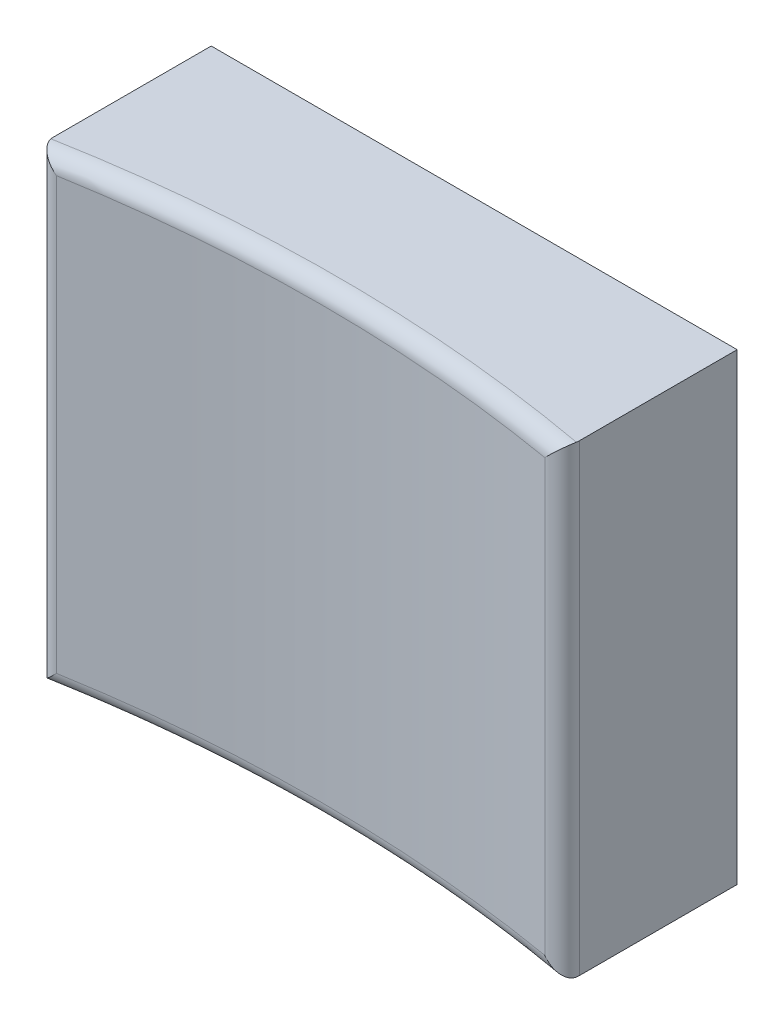
from build123d import *

# Parameters (mm, degrees)
SKETCH1_W      = 8.3058
SKETCH1_H      = 7.3152
KEY_DEPTH      = 2.794
EXTRUDE2_DEPTH = 9.86369931
FILLET1_R      = 0.254


with BuildPart() as part:
    # Sketch1 → key (new body)
    with BuildSketch(Plane.XY):
        Rectangle(SKETCH1_W, SKETCH1_H)
    extrude(amount=KEY_DEPTH)

    # Sketch2 → Extrude2 (cut, through all)
    with BuildSketch(Plane.XZ.offset(3.6576)):
        with BuildLine():
            ThreePointArc((-4.1529, 2.794), (0, 2.413613466), (4.1529, 2.794))
            Line((4.1529, 2.794), (-4.1529, 2.794))
        make_face()
    extrude(amount=-EXTRUDE2_DEPTH, mode=Mode.SUBTRACT)

    # Fillet1
    fillet1_edges = [part.edges().sort_by_distance(p)[0] for p in [
        (4.1529, 0, 2.794),
        (0, 3.6576, 2.413613466),
        (0, -3.6576, 2.413613466),
        (-4.1529, 0, 2.794),
    ]]
    fillet(fillet1_edges, radius=FILLET1_R)


solid = part.part
